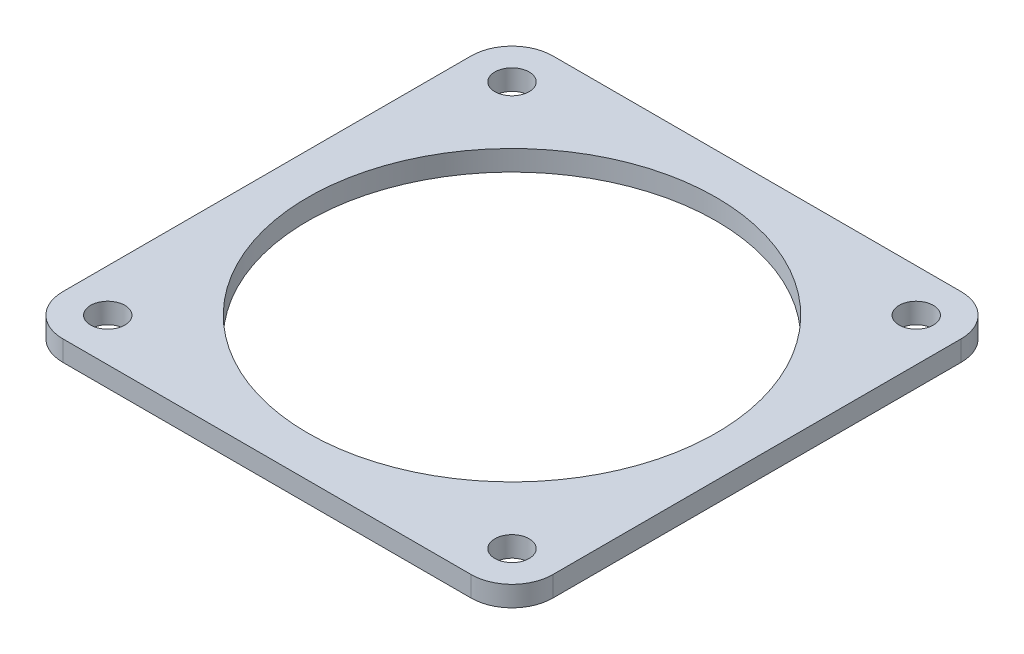
from build123d import *

# Parameters (mm, degrees)
SKETCH1_W           = 76.2
SKETCH1_H           = 76.2
SKETCH1_R           = 31.75
BOSS_EXTRUDE1_DEPTH = 3.175
CUT_EXTRUDE1_REACH  = 55.975
SKETCH2_R           = 2.665
CIRPATTERN1_COUNT   = 4
FILLET1_R           = 6.35


with BuildPart() as part:
    # Sketch1 → Boss-Extrude1 (new body)
    with BuildSketch(Plane(origin=(0, 0, 0), x_dir=(1, 0, 0), z_dir=(0, 1, 0))):
        Rectangle(SKETCH1_W, SKETCH1_H)
        with Locations(Location((0, 0, 0), (0, 0, 270))):
            Circle(SKETCH1_R, mode=Mode.SUBTRACT)
    extrude(amount=BOSS_EXTRUDE1_DEPTH)

    # Sketch2 → Cut-Extrude1 (cut, up to next)
    with BuildSketch(Plane(origin=(0, 3.175, 0), x_dir=(1, 0, 0), z_dir=(0, 1, 0)), mode=Mode.PRIVATE) as cut_extrude1_sk1:
        with Locations(Location((31.430896424, 31.430896424, 0), (0, 0, 270))):
            Circle(SKETCH2_R)
    cut_extrude1_tool1 = extrude(cut_extrude1_sk1.sketch, amount=-CUT_EXTRUDE1_REACH, mode=Mode.PRIVATE) & part.part
    cut_extrude1 = cut_extrude1_tool1.solids().sort_by_distance((31.430896, 3.175, -31.430896))[0]
    add(cut_extrude1, mode=Mode.SUBTRACT)

    # CirPattern1: Cut-Extrude1 ×4 about axis
    cirpattern1_axis = Axis((0, 0, 0), (0, 1, 0))
    for i in range(1, CIRPATTERN1_COUNT):
        add(cut_extrude1.rotate(cirpattern1_axis, i * 360 / CIRPATTERN1_COUNT), mode=Mode.SUBTRACT)

    # Fillet1
    fillet1_edges = [part.edges().sort_by_distance(p)[0] for p in [
        (38.1, 1.5875, 38.1),
        (-38.1, 1.5875, 38.1),
        (-38.1, 1.5875, -38.1),
        (38.1, 1.5875, -38.1),
    ]]
    fillet(fillet1_edges, radius=FILLET1_R)


solid = part.part
